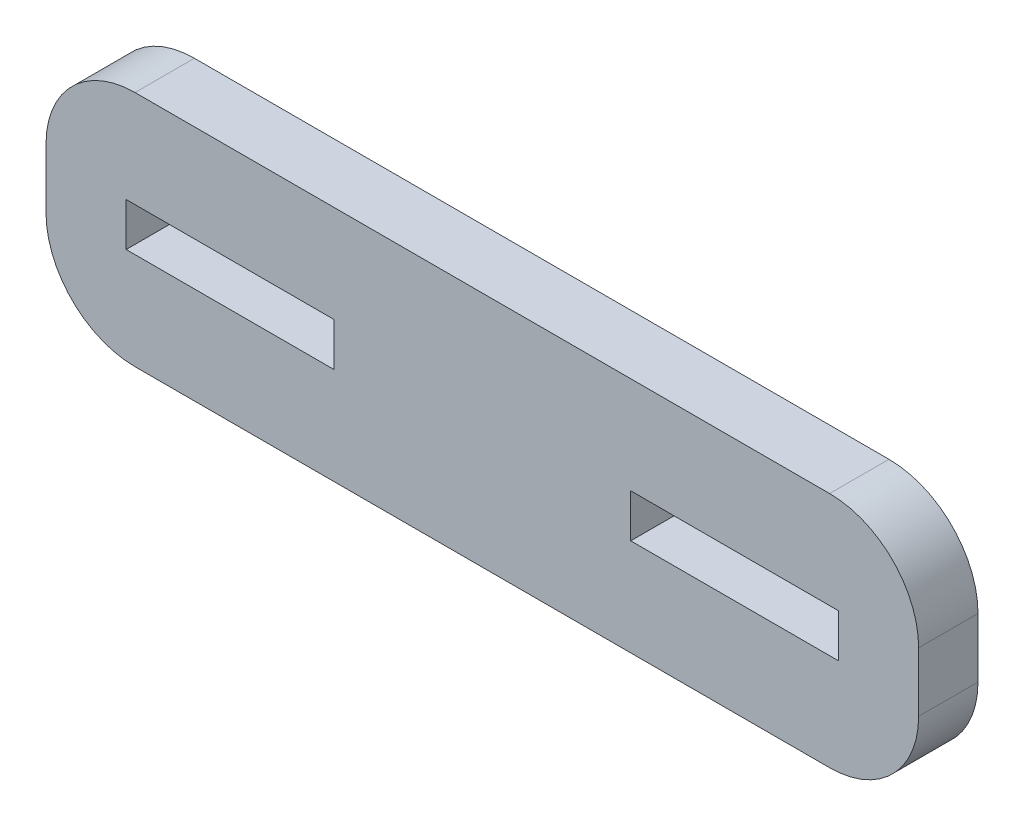
from build123d import *

# Parameters (mm, degrees)
SKETCH1_W           = 7
SKETCH1_H           = 1.46
BOSS_EXTRUDE1_DEPTH = 2


with BuildPart() as part:
    # Sketch1 → Boss-Extrude1 (new body)
    with BuildSketch(Plane.XY):
        with BuildLine():
            Line((-31.064544979, 27.784009845), (-7.664544979, 27.784009845))
            ThreePointArc((-7.664544979, 27.784009845), (-5.543224635, 26.905330188), (-4.664544979, 24.784009845))
            Line((-4.664544979, 24.784009845), (-4.664544979, 22.784009845))
            ThreePointArc((-4.664544979, 22.784009845), (-5.543224635, 20.662689501), (-7.664544979, 19.784009845))
            Line((-7.664544979, 19.784009845), (-31.064544979, 19.784009845))
            ThreePointArc((-31.064544979, 19.784009845), (-33.185865322, 20.662689501), (-34.064544979, 22.784009845))
            Line((-34.064544979, 22.784009845), (-34.064544979, 24.784009845))
            ThreePointArc((-34.064544979, 24.784009845), (-33.185865322, 26.905330188), (-31.064544979, 27.784009845))
        make_face()
        with Locations((-27.864544979, 23.784009845)):
            Rectangle(SKETCH1_W, SKETCH1_H, mode=Mode.SUBTRACT)
        with Locations((-10.864544979, 23.784009845)):
            Rectangle(SKETCH1_W, SKETCH1_H, mode=Mode.SUBTRACT)
    extrude(amount=BOSS_EXTRUDE1_DEPTH)


solid = part.part
